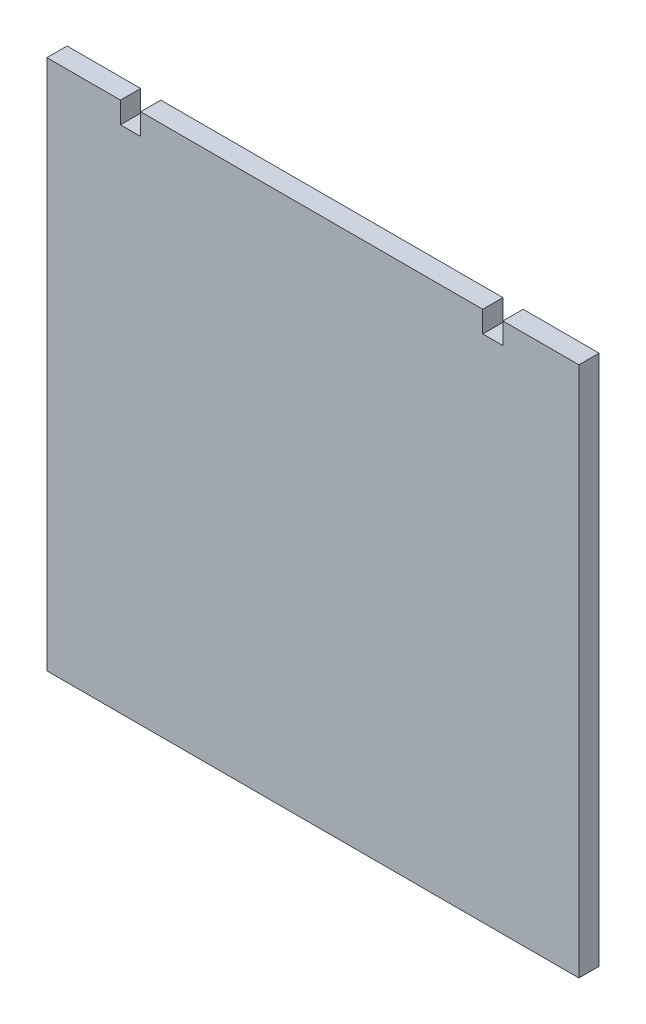
from build123d import *

# Parameters (mm, degrees)
BOSS_EXTRUDE1_DEPTH = 2.9972


with BuildPart() as part:
    # Sketch1 → Boss-Extrude1 (new body)
    with BuildSketch(Plane.XY):
        Polygon((10.925, 78.867), (10.925, 75.692), (13.9222, 75.692), (13.9222, 78.867), (64.7222, 78.867), (64.7222, 75.692), (67.7194, 75.692), (67.7194, 78.867), (79, 78.867), (79, 0), (0, 0), (0, 78.867), align=None)
    extrude(amount=BOSS_EXTRUDE1_DEPTH)


solid = part.part
